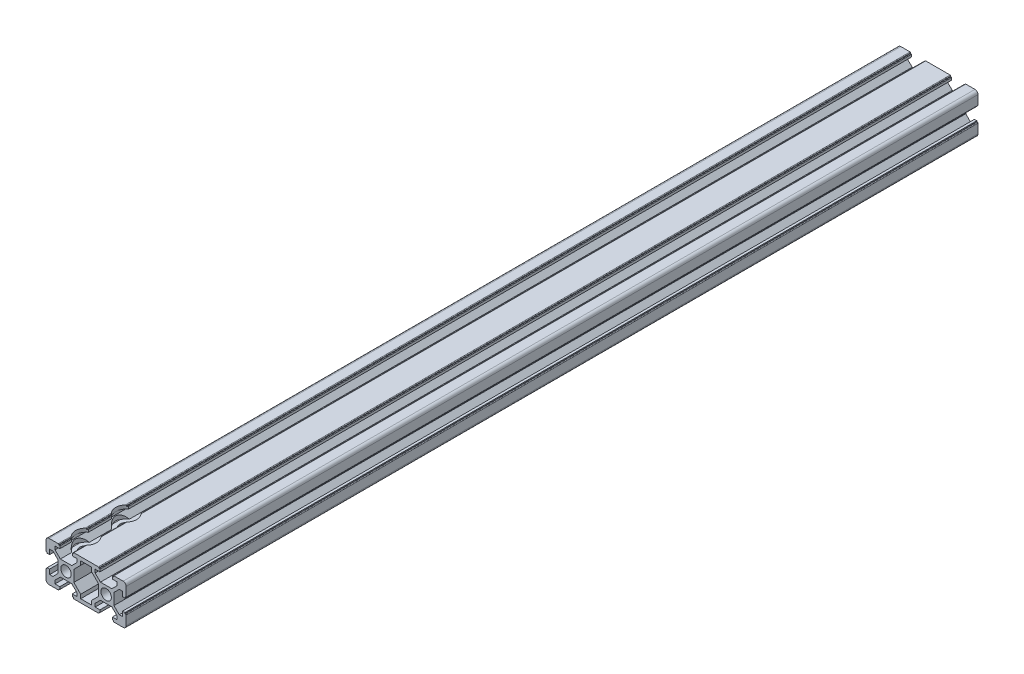
from build123d import *

# Parameters (mm, degrees)
SKETCH_1_R               = 2.6
EXTRUDE_1_DEPTH          = 212.5
FILLET_1_R               = 1.5
FILLET_2_R               = 0.3
CUT_EXTRUDE_1_DEPTH      = 214.891234042
CUT_EXTRUDE_1_DEPTH_BACK = 214.891234042
SKETCH_2_R               = 3.1
SKETCH_3_R               = 5.25
CUT_EXTRUDE_2_DEPTH      = 214.891234141


with BuildPart() as part:
    # 草图1 → 凸台-拉伸1 (new, symmetric)
    with BuildSketch(Plane.XY):
        Polygon((-13.9, 0), (-13.9, 2.839339828), (-16.560660172, 5.5), (-18.2, 5.5), (-18.2, 3.1), (-19.4, 3.1), (-19.4, 3.6), (-20, 3.6), (-20, 10), (-13.6, 10), (-13.6, 9.4), (-13.1, 9.4), (-13.1, 8.2), (-15.5, 8.2), (-15.5, 6.560660172), (-12.839339828, 3.9), (-7.160660172, 3.9), (-4.5, 6.560660172), (-4.5, 8.2), (-6.9, 8.2), (-6.9, 9.4), (-6.4, 9.4), (-6.4, 10), (6.4, 10), (6.4, 9.4), (6.9, 9.4), (6.9, 8.2), (4.5, 8.2), (4.5, 6.560660172), (7.160660172, 3.9), (12.839339828, 3.9), (15.5, 6.560660172), (15.5, 8.2), (13.1, 8.2), (13.1, 9.4), (13.6, 9.4), (13.6, 10), (20, 10), (20, 3.6), (19.4, 3.6), (19.4, 3.1), (18.2, 3.1), (18.2, 5.5), (16.560660172, 5.5), (13.9, 2.839339828), (13.9, 0), (13.9, -2.839339828), (16.560660172, -5.5), (18.2, -5.5), (18.2, -3.1), (19.4, -3.1), (19.4, -3.6), (20, -3.6), (20, -10), (13.6, -10), (13.6, -9.4), (13.1, -9.4), (13.1, -8.2), (15.5, -8.2), (15.5, -6.560660172), (12.839339828, -3.9), (7.160660172, -3.9), (4.5, -6.560660172), (4.5, -8.2), (6.9, -8.2), (6.9, -9.4), (6.4, -9.4), (6.4, -10), (-6.4, -10), (-6.4, -9.4), (-6.9, -9.4), (-6.9, -8.2), (-4.5, -8.2), (-4.5, -6.560660172), (-7.160660172, -3.9), (-12.839339828, -3.9), (-15.5, -6.560660172), (-15.5, -8.2), (-13.1, -8.2), (-13.1, -9.4), (-13.6, -9.4), (-13.6, -10), (-20, -10), (-20, -3.6), (-19.4, -3.6), (-19.4, -3.1), (-18.2, -3.1), (-18.2, -5.5), (-16.560660172, -5.5), (-13.9, -2.839339828), align=None)
        with Locations((-10, 0)):
            Circle(SKETCH_1_R, mode=Mode.SUBTRACT)
        with Locations(Location((10, 0, 0), (0, 0, 180))):
            Circle(SKETCH_1_R, mode=Mode.SUBTRACT)
        Polygon((-6.1, -2.839339828), (-6.1, 2.839339828), (-2.7, 6.239339828), (-2.7, 8.2), (2.7, 8.2), (2.7, 6.239339828), (6.1, 2.839339828), (6.1, -2.839339828), (2.7, -6.239339828), (2.7, -8.2), (-2.7, -8.2), (-2.7, -6.239339828), align=None, mode=Mode.SUBTRACT)
    extrude(amount=EXTRUDE_1_DEPTH, both=True)

    # 圆角1
    fillet_1_edges = [part.edges().sort_by_distance(p)[0] for p in [
        (-20, 10, 0),
        (20, 10, 0),
        (20, -10, 0),
        (-20, -10, 0),
    ]]
    fillet(fillet_1_edges, radius=FILLET_1_R)

    # 圆角2
    fillet_2_edges = [part.edges().sort_by_distance(p)[0] for p in [
        (-20, 3.6, 0),
        (-13.6, 10, 0),
        (-6.4, 10, 0),
        (6.4, 10, 0),
        (13.6, 10, 0),
        (20, 3.6, 0),
        (20, -3.6, 0),
        (13.6, -10, 0),
        (6.4, -10, 0),
        (-6.4, -10, 0),
        (-13.6, -10, 0),
        (-20, -3.6, 0),
    ]]
    fillet(fillet_2_edges, radius=FILLET_2_R)

    # 草图2 → 切除-拉伸1 (cut, two sides: drawn at the far end of the back side and taken through both)
    with BuildSketch(Plane(origin=(0, 3.9, 0), x_dir=(1, 0, 0), z_dir=(0, 1, 0)).offset(-CUT_EXTRUDE_1_DEPTH_BACK)):
        with Locations(Location((-10, -202.5, 0), (0, 0, 336.336158428))):
            Circle(SKETCH_2_R)
        with Locations(Location((-10, -182.5, 0), (0, 0, 336.336158428))):
            Circle(SKETCH_2_R)
    extrude(amount=CUT_EXTRUDE_1_DEPTH + CUT_EXTRUDE_1_DEPTH_BACK, mode=Mode.SUBTRACT)

    # 草图3 → 切除-拉伸2 (cut, through all)
    with BuildSketch(Plane(origin=(0, 3.9, 0), x_dir=(1, 0, 0), z_dir=(0, 1, 0))):
        with Locations((-10, -182.5)):
            Circle(SKETCH_3_R)
        with Locations((-10, -202.5)):
            Circle(SKETCH_3_R)
    extrude(amount=CUT_EXTRUDE_2_DEPTH, mode=Mode.SUBTRACT)


solid = part.part
